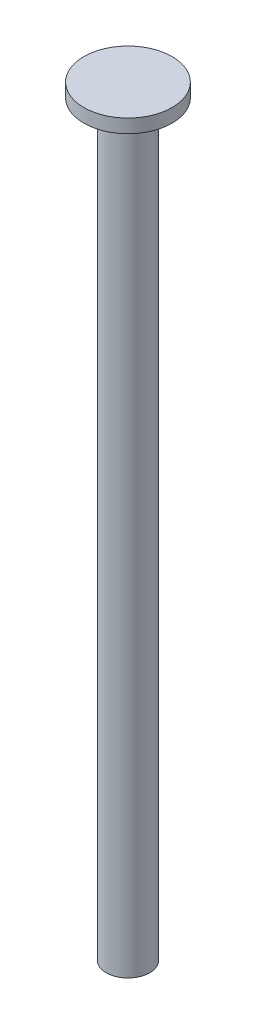
from build123d import *

# Parameters (mm, degrees)
SKETCH1_R           = 3.25
BOSS_EXTRUDE1_DEPTH = 1
SKETCH2_R           = 1.6
BOSS_EXTRUDE2_DEPTH = 55


with BuildPart() as part:
    # Sketch1 → Boss-Extrude1 (new body)
    with BuildSketch(Plane(origin=(0, 0, 0), x_dir=(1, 0, 0), z_dir=(0, 1, 0))):
        with Locations(Location((0, 0, 0), (0, 0, 270))):
            Circle(SKETCH1_R)
    extrude(amount=BOSS_EXTRUDE1_DEPTH)

    # Sketch2 → Boss-Extrude2 (add)
    with BuildSketch(Plane(origin=(0, 0, 0), x_dir=(1, 0, 0), z_dir=(0, 1, 0))):
        with Locations(Location((0, 0, 0), (0, 0, 270))):
            Circle(SKETCH2_R)
    extrude(amount=-BOSS_EXTRUDE2_DEPTH)


solid = part.part
